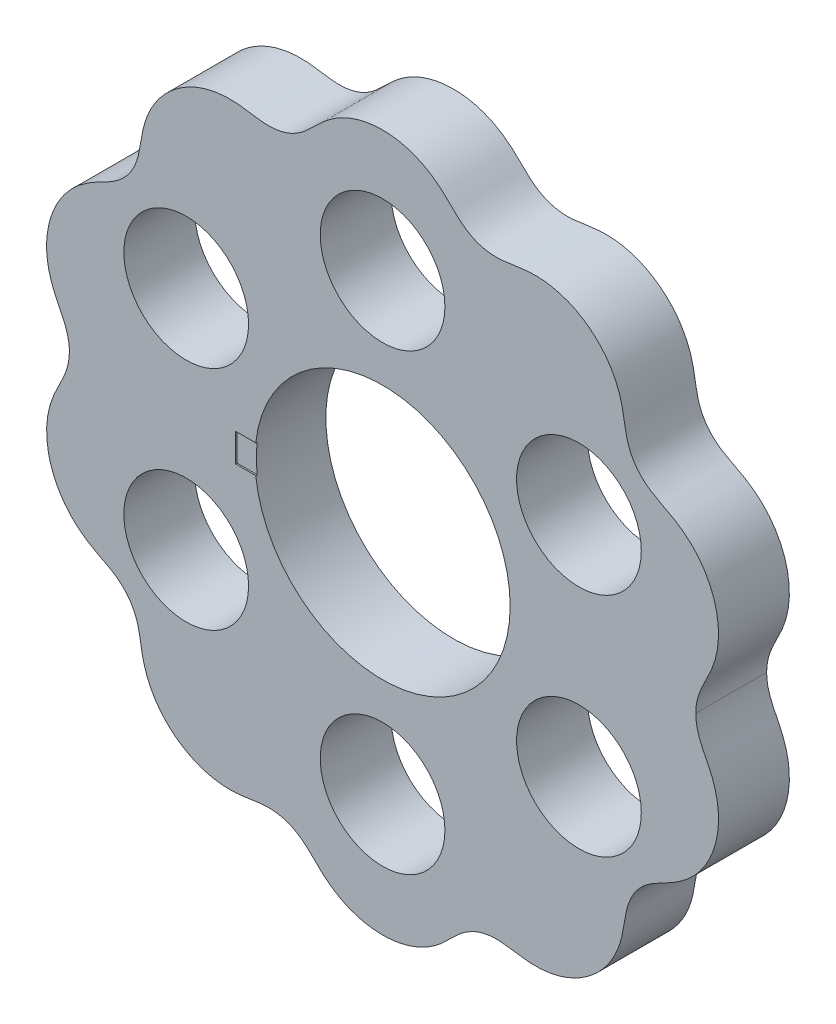
from build123d import *

# Parameters (mm, degrees)
SKETCH2_R           = 9.0043
SKETCH2_R_2         = 4.4
BOSS_EXTRUDE1_DEPTH = 5
CUT_EXTRUDE1_DEPTH  = 0.1


with BuildPart() as part:
    # Sketch2 → Boss-Extrude1 (new body)
    with BuildSketch(Plane.XY.offset(-1165.042287492)):
        with BuildLine():
            add(Edge.make_bspline(
                [(22.1, 0), (22.1, -0.029302567), (22.100656996, -0.073267299), (22.102846978, -0.150479345), (22.107765032, -0.243024679), (22.113002169, -0.31356521), (22.121167512, -0.399042775), (22.137660505, -0.535547313), (22.168477812, -0.725309174), (22.221962498, -0.961733919), (22.301132136, -1.228529968), (22.396248759, -1.489311546), (22.504572502, -1.745256299), (22.622714563, -1.996489409), (22.746713886, -2.245018567), (22.87241041, -2.492573124), (22.995858066, -2.741341347), (23.143387346, -3.055544856), (23.304631036, -3.439826563), (23.489677504, -3.978553819), (23.651034334, -4.683442393), (23.730085815, -5.486733771), (23.690072978, -6.376338564), (23.526656928, -7.245430382), (23.246859664, -8.078377589), (22.858354421, -8.859291128), (22.36991344, -9.575757168), (21.746771046, -10.259536929), (20.979757182, -10.880170438), (20.07185269, -11.393514988), (19.074956387, -11.857034761), (18.181387307, -12.525379462), (17.522574849, -13.435236027), (17.165903162, -14.499100143), (17.035166981, -15.602135191), (16.773131617, -16.850230243), (16.183180557, -18.169843002), (15.185324779, -19.426415814), (13.758890787, -20.45679901), (12.257817895, -21.009294245), (10.828993799, -21.15920723), (9.560643085, -21.020485338), (8.461027709, -20.802084394), (7.328375606, -20.821045963), (6.253101017, -21.181361325), (5.341855753, -21.842454293), (4.590177093, -22.657661818), (3.646274458, -23.503590974), (2.404327803, -24.212967426), (0.872596385, -24.63896937), (-0.872596249, -24.638969598), (-2.404328196, -24.212967156), (-3.646273705, -23.503591358), (-4.590178654, -22.657661122), (-5.341852785, -21.84245556), (-6.253105576, -21.1813594), (-7.328368243, -20.821049059), (-8.46104013, -20.80207918), (-9.560620352, -21.020494874), (-10.829032369, -21.159191057), (-12.257759872, -21.009318559), (-13.741024473, -20.463370436), (-15.139383208, -19.4615155), (-16.041258918, -18.353410382), (-16.553530054, -17.344966352), (-16.819283882, -16.538402702), (-16.951869323, -15.981061926), (-17.071894903, -15.275534032), (-17.175369193, -14.567994024), (-17.371218875, -13.874397941), (-17.759814305, -13.10553406), (-18.30130832, -12.427799863), (-19.120124546, -11.828042716), (-20.161840701, -11.354111243), (-21.266581229, -10.70199441), (-22.310551276, -9.733982335), (-23.165156921, -8.427533899), (-23.625552587, -7.017417615), (-23.746197848, -5.757684391), (-23.663442889, -4.777094196), (-23.518570066, -4.085486246), (-23.321955401, -3.476877841), (-23.100306653, -2.948620034), (-22.84529241, -2.436105267), (-22.615965168, -1.990999888), (-22.408917504, -1.534577596), (-22.277167112, -1.163364664), (-22.202479171, -0.886606409), (-22.154838808, -0.640885487), (-22.13560223, -0.516552839), (-22.122473754, -0.410978079), (-22.113805721, -0.322921864), (-22.10824541, -0.250610924), (-22.104067745, -0.17471333), (-22.1012791, -0.097385476), (-22.100232564, -0.045489039), (-22.1, -0.015098243), (-22.1, 0)],
                knots=[0.07789061, 0.07789061, 0.07789061, 0.07789061, 0.07789061, 0.079370354, 0.080110226, 0.080850098, 0.08158997, 0.082329842, 0.083809586, 0.086769074, 0.089728562, 0.09268805, 0.095647538, 0.098607026, 0.101566514, 0.104526002, 0.10748549, 0.110444978, 0.113404466, 0.119323442, 0.125242418, 0.134700775, 0.144159132, 0.15361749, 0.163075847, 0.172283742, 0.181491636, 0.190699531, 0.199907426, 0.211620029, 0.223332633, 0.235045236, 0.24675784, 0.258595752, 0.270433664, 0.282271576, 0.294109487, 0.312775713, 0.331441938, 0.349816075, 0.368190212, 0.380135666, 0.392081119, 0.404026572, 0.415972026, 0.427791948, 0.43961187, 0.451431791, 0.463251713, 0.481625819, 0.499999926, 0.518374032, 0.536748138, 0.54856806, 0.560387982, 0.572207904, 0.584027825, 0.595973279, 0.607918732, 0.619864186, 0.631809639, 0.650183776, 0.668557913, 0.68641831, 0.704278706, 0.710378253, 0.716477801, 0.722577348, 0.728676896, 0.740875991, 0.746975538, 0.753075086, 0.765274168, 0.77747325, 0.789672332, 0.801871414, 0.819731822, 0.83759223, 0.855452636, 0.864382839, 0.873313042, 0.879412586, 0.885512129, 0.891611673, 0.897711216, 0.903810759, 0.906860531, 0.912960075, 0.91448496, 0.916009846, 0.917534732, 0.918297175, 0.919059618, 0.919822061, 0.920584504, 0.921346947, 0.92210939, 0.92210939, 0.92210939, 0.92210939, 0.92210939], degree=4))
            add(Edge.make_bspline(
                [(22.1, 0), (22.1, 0.029302567), (22.100656996, 0.073267299), (22.102846978, 0.150479345), (22.107765032, 0.243024679), (22.113002169, 0.31356521), (22.121167512, 0.399042775), (22.137660505, 0.535547313), (22.168477812, 0.725309174), (22.221962498, 0.961733919), (22.301132136, 1.228529968), (22.396248759, 1.489311546), (22.504572502, 1.745256299), (22.622714563, 1.996489409), (22.746713886, 2.245018567), (22.87241041, 2.492573124), (22.995858066, 2.741341347), (23.143387346, 3.055544856), (23.304631036, 3.439826563), (23.489677504, 3.978553819), (23.651034334, 4.683442393), (23.730085815, 5.486733771), (23.690072978, 6.376338564), (23.526656928, 7.245430382), (23.246859664, 8.078377589), (22.858354421, 8.859291128), (22.36991344, 9.575757168), (21.746771046, 10.259536929), (20.979757182, 10.880170438), (20.07185269, 11.393514988), (19.074956387, 11.857034761), (18.181387307, 12.525379462), (17.522574849, 13.435236027), (17.165903162, 14.499100143), (17.035166981, 15.602135191), (16.773131617, 16.850230243), (16.183180557, 18.169843002), (15.185324779, 19.426415814), (13.758890787, 20.45679901), (12.257817895, 21.009294245), (10.828993799, 21.15920723), (9.560643085, 21.020485338), (8.461027709, 20.802084394), (7.328375606, 20.821045963), (6.253101017, 21.181361325), (5.341855753, 21.842454293), (4.590177093, 22.657661818), (3.646274458, 23.503590974), (2.404327803, 24.212967426), (0.872596385, 24.63896937), (-0.872596249, 24.638969598), (-2.404328196, 24.212967156), (-3.646273705, 23.503591358), (-4.590178654, 22.657661122), (-5.341852785, 21.84245556), (-6.253105576, 21.1813594), (-7.328368243, 20.821049059), (-8.46104013, 20.80207918), (-9.560620352, 21.020494874), (-10.829032369, 21.159191057), (-12.257759872, 21.009318559), (-13.741024473, 20.463370436), (-15.139383208, 19.4615155), (-16.041258918, 18.353410382), (-16.553530054, 17.344966352), (-16.819283882, 16.538402702), (-16.951869323, 15.981061926), (-17.071894903, 15.275534032), (-17.175369193, 14.567994024), (-17.371218875, 13.874397941), (-17.759814305, 13.10553406), (-18.30130832, 12.427799862), (-19.120124546, 11.828042716), (-20.161840701, 11.354111243), (-21.266581229, 10.70199441), (-22.310551276, 9.733982335), (-23.165156921, 8.427533899), (-23.625552587, 7.017417615), (-23.746197848, 5.757684391), (-23.663442889, 4.777094196), (-23.518570066, 4.085486246), (-23.321955401, 3.476877841), (-23.100306653, 2.948620034), (-22.84529241, 2.436105267), (-22.615965168, 1.990999888), (-22.408917504, 1.534577596), (-22.277167112, 1.163364663), (-22.202479171, 0.886606409), (-22.154838808, 0.640885487), (-22.13560223, 0.516552839), (-22.122473754, 0.410978079), (-22.113805721, 0.322921864), (-22.10824541, 0.250610923), (-22.104067745, 0.17471333), (-22.1012791, 0.097385476), (-22.100232564, 0.045489039), (-22.1, 0.015098243), (-22.1, 0)],
                knots=[0.07789061, 0.07789061, 0.07789061, 0.07789061, 0.07789061, 0.079370354, 0.080110226, 0.080850098, 0.08158997, 0.082329842, 0.083809586, 0.086769074, 0.089728562, 0.09268805, 0.095647538, 0.098607026, 0.101566514, 0.104526002, 0.10748549, 0.110444978, 0.113404466, 0.119323442, 0.125242418, 0.134700775, 0.144159132, 0.15361749, 0.163075847, 0.172283742, 0.181491636, 0.190699531, 0.199907426, 0.211620029, 0.223332633, 0.235045236, 0.24675784, 0.258595752, 0.270433664, 0.282271576, 0.294109487, 0.312775713, 0.331441938, 0.349816075, 0.368190212, 0.380135666, 0.392081119, 0.404026572, 0.415972026, 0.427791948, 0.43961187, 0.451431791, 0.463251713, 0.481625819, 0.499999926, 0.518374032, 0.536748138, 0.54856806, 0.560387982, 0.572207904, 0.584027825, 0.595973279, 0.607918732, 0.619864186, 0.631809639, 0.650183776, 0.668557913, 0.68641831, 0.704278706, 0.710378253, 0.716477801, 0.722577348, 0.728676896, 0.740875991, 0.746975538, 0.753075086, 0.765274168, 0.77747325, 0.789672332, 0.801871414, 0.819731822, 0.83759223, 0.855452636, 0.864382839, 0.873313042, 0.879412586, 0.885512129, 0.891611673, 0.897711216, 0.903810759, 0.906860531, 0.912960075, 0.91448496, 0.916009846, 0.917534732, 0.918297175, 0.919059618, 0.919822061, 0.920584504, 0.921346947, 0.92210939, 0.92210939, 0.92210939, 0.92210939, 0.92210939], degree=4))
        make_face()
        Circle(SKETCH2_R, mode=Mode.SUBTRACT)
        with Locations((13.856406461, 8)):
            Circle(SKETCH2_R_2, mode=Mode.SUBTRACT)
        with Locations((13.856406461, -8)):
            Circle(SKETCH2_R_2, mode=Mode.SUBTRACT)
        with Locations((0, -16)):
            Circle(SKETCH2_R_2, mode=Mode.SUBTRACT)
        with Locations((-13.856406461, -8)):
            Circle(SKETCH2_R_2, mode=Mode.SUBTRACT)
        with Locations((-13.856406461, 8)):
            Circle(SKETCH2_R_2, mode=Mode.SUBTRACT)
        with Locations((0, 16)):
            Circle(SKETCH2_R_2, mode=Mode.SUBTRACT)
    extrude(amount=-BOSS_EXTRUDE1_DEPTH)

    # Sketch3 → Cut-Extrude1 (cut)
    with BuildSketch(Plane.XY.offset(-1165.042287492)):
        Polygon((-10.388759749, -1), (-10.388759749, 1), (-8.742920185, 1), (-8.663892273, 1), (-8.663892273, -1), align=None)
    extrude(amount=-CUT_EXTRUDE1_DEPTH, mode=Mode.SUBTRACT)


solid = part.part
